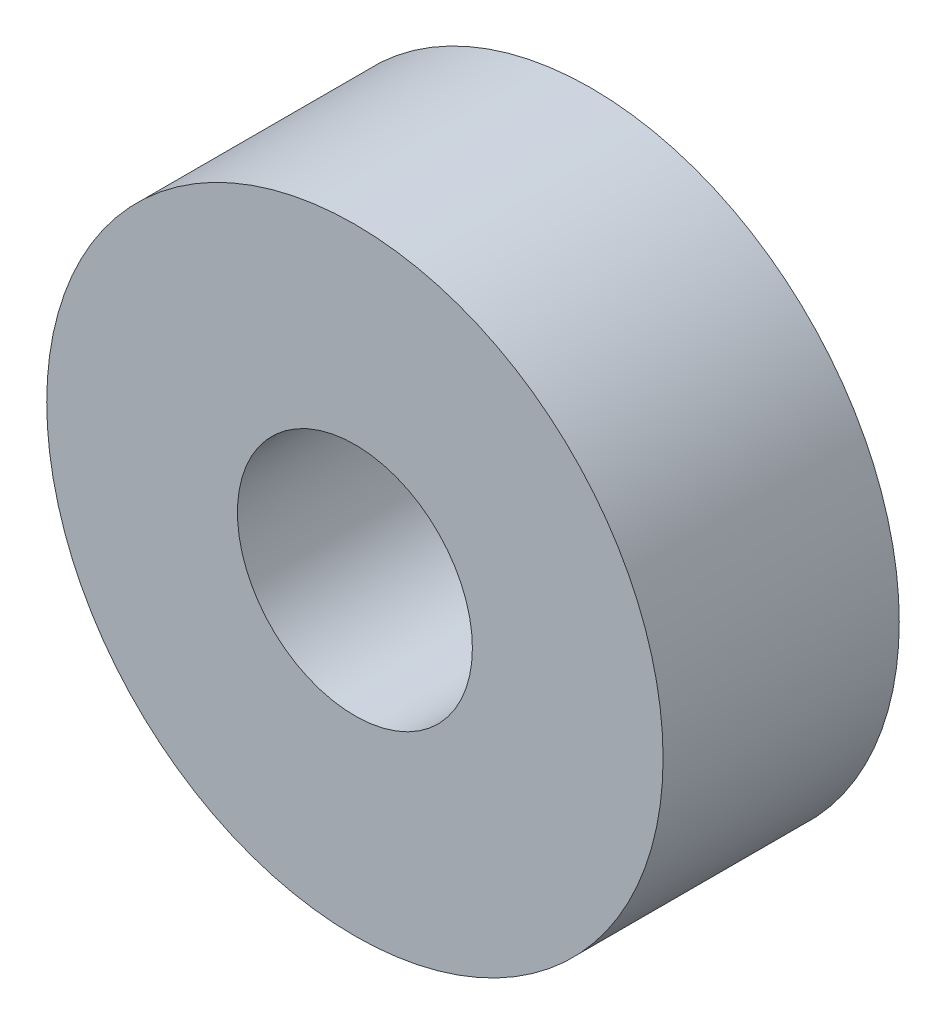
from build123d import *

# Parameters (mm, degrees)
SKETCH1_R      = 12.9921
SKETCH1_R_2    = 4.953
EXTRUDE1_DEPTH = 9.9568


with BuildPart() as part:
    # Sketch1 → Extrude1 (new body)
    with BuildSketch(Plane.XY):
        Circle(SKETCH1_R)
        Circle(SKETCH1_R_2, mode=Mode.SUBTRACT)
    extrude(amount=EXTRUDE1_DEPTH)


solid = part.part
